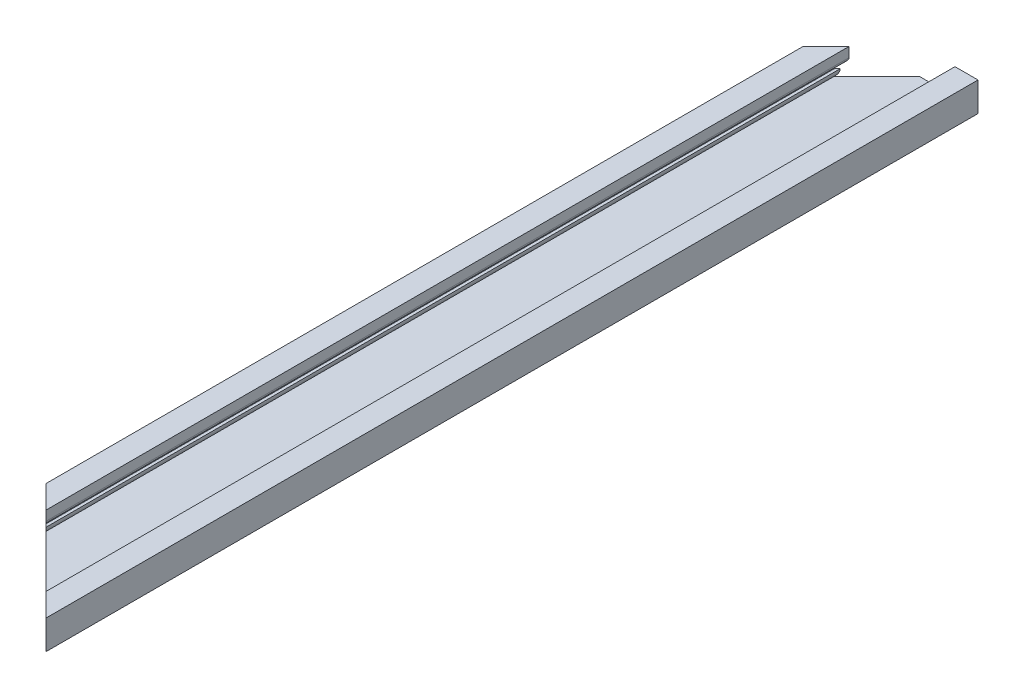
from build123d import *

# Parameters (mm, degrees)
SKETCH_1_W               = 60
SKETCH_1_H               = 15
EXTRUDE_1_DEPTH          = 510
SKETCH_2_R               = 3
CUT_EXTRUDE_1_DEPTH      = 511.936639908
CUT_EXTRUDE_2_DEPTH      = 511.936639908
SKETCH_4_W               = 36.3
SKETCH_4_H               = 7
CUT_EXTRUDE_3_DEPTH      = 511.936639908
FILLET_1_R               = 2
CUT_EXTRUDE_4_DEPTH      = 512.101751122
CUT_EXTRUDE_6_DEPTH      = 512.101751122
CUT_EXTRUDE_6_DEPTH_BACK = 512.101751122
SKETCH_7_W               = 30
SKETCH_7_H               = 30


with BuildPart() as part:
    # 스케치1 → 보스-돌출1 (new body)
    with BuildSketch(Plane.XY):
        Rectangle(SKETCH_1_W, SKETCH_1_H)
    extrude(amount=EXTRUDE_1_DEPTH)

    # 스케치2 → 컷-돌출1 (cut, through all)
    with BuildSketch(Plane(origin=(0, 0, 0), x_dir=(-1, 0, 0), z_dir=(0, 0, -1))):
        with Locations((-25, -2.5)):
            Circle(SKETCH_2_R)
        with Locations((25, -2.5)):
            Circle(SKETCH_2_R)
    extrude(amount=-CUT_EXTRUDE_1_DEPTH, mode=Mode.SUBTRACT)

    # 스케치3 → 컷-돌출2 (cut, through all)
    with BuildSketch(Plane(origin=(0, 0, 0), x_dir=(-1, 0, 0), z_dir=(0, 0, -1))):
        with BuildLine():
            Line((-22.171572875, -6), (22.171572875, -6))
            ThreePointArc((22.171572875, -6), (20.939339828, -4.439339828), (20.5, -2.5))
            Line((20.5, -2.5), (25, -2.5))
            Line((25, -2.5), (25, 0.5))
            Line((25, 0.5), (-25, 0.5))
            Line((-25, 0.5), (-25, -2.5))
            Line((-25, -2.5), (-20.5, -2.5))
            ThreePointArc((-20.5, -2.5), (-20.939339828, -4.439339828), (-22.171572875, -6))
        make_face()
    extrude(amount=-CUT_EXTRUDE_2_DEPTH, mode=Mode.SUBTRACT)

    # 스케치4 → 컷-돌출3 (cut, through all)
    with BuildSketch(Plane(origin=(0, 0, 0), x_dir=(-1, 0, 0), z_dir=(0, 0, -1))):
        with Locations((0.006888359, 4)):
            Rectangle(SKETCH_4_W, SKETCH_4_H)
    extrude(amount=-CUT_EXTRUDE_3_DEPTH, mode=Mode.SUBTRACT)

    # 필렛1
    fillet_1_edges = [part.edges().sort_by_distance(p)[0] for p in [
        (-18.156888359, 0.5, 255),
        (18.143111641, 0.5, 255),
    ]]
    fillet(fillet_1_edges, radius=FILLET_1_R)

    # 스케치5 → 컷-돌출4 (cut, through all)
    with BuildSketch(Plane.XZ.offset(7.5)):
        Polygon((-30, 510), (-30, 450), (30, 510), align=None)
        Polygon((-30, 0), (30, 0), (-30, 60), align=None)
    extrude(amount=-CUT_EXTRUDE_4_DEPTH, mode=Mode.SUBTRACT)

    # 스케치7 → 컷-돌출6 (cut, two sides: drawn at the far end of the back side and taken through both)
    with BuildSketch(Plane.XZ.offset(7.5).offset(-CUT_EXTRUDE_6_DEPTH_BACK)):
        with Locations((15, 15)):
            Rectangle(SKETCH_7_W, SKETCH_7_H)
    extrude(amount=CUT_EXTRUDE_6_DEPTH + CUT_EXTRUDE_6_DEPTH_BACK, mode=Mode.SUBTRACT)


solid = part.part
